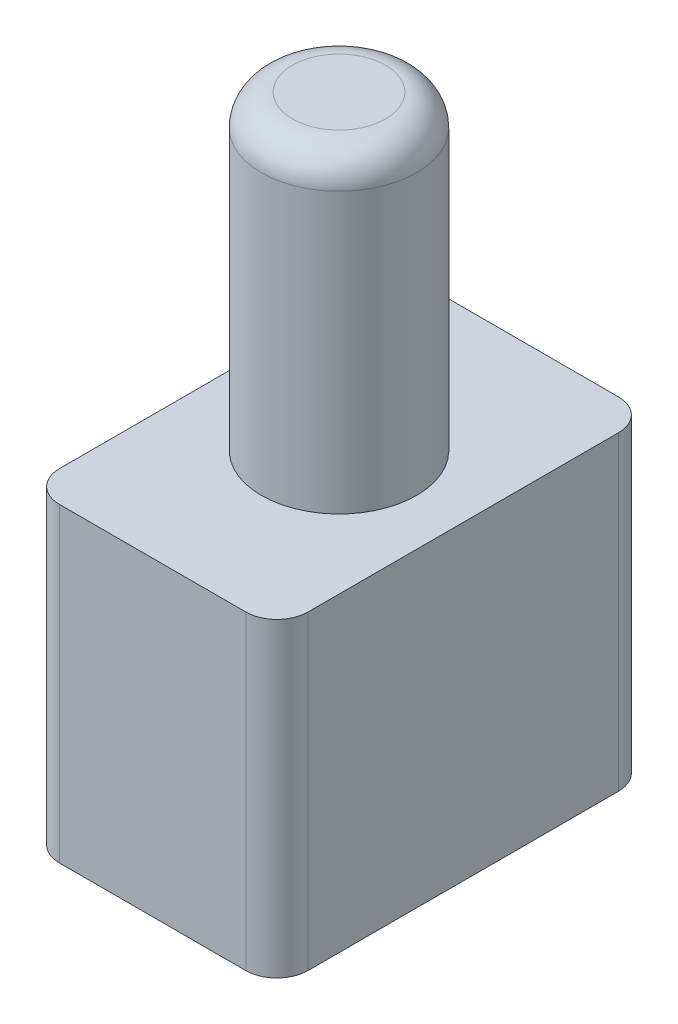
from build123d import *

# Parameters (mm, degrees)
SKETCH1_W           = 8
SKETCH1_H           = 12
BOSS_EXTRUDE1_DEPTH = 10
SKETCH2_R           = 2.5
BOSS_EXTRUDE2_DEPTH = 10
FILLET1_R           = 1
FILLET2_R           = 1


with BuildPart() as part:
    # Sketch1 → Boss-Extrude1 (new body)
    with BuildSketch(Plane(origin=(0, 0, 0), x_dir=(1, 0, 0), z_dir=(0, 1, 0))):
        with Locations((4, 6)):
            Rectangle(SKETCH1_W, SKETCH1_H)
    extrude(amount=BOSS_EXTRUDE1_DEPTH)

    # Sketch2 → Boss-Extrude2 (add)
    with BuildSketch(Plane(origin=(0, 10, 0), x_dir=(1, 0, 0), z_dir=(0, 1, 0))):
        with Locations(Location((4, 6, 0), (0, 0, 270))):
            Circle(SKETCH2_R)
    extrude(amount=BOSS_EXTRUDE2_DEPTH)

    # Fillet1
    fillet1_edges = [part.edges().sort_by_distance(p)[0] for p in [
        (4, 20, -8.5),
    ]]
    fillet(fillet1_edges, radius=FILLET1_R)

    # Fillet2
    fillet2_edges = [part.edges().sort_by_distance(p)[0] for p in [
        (0, 5, -12),
        (8, 5, -12),
        (8, 5, 0),
        (0, 5, 0),
    ]]
    fillet(fillet2_edges, radius=FILLET2_R)


solid = part.part
